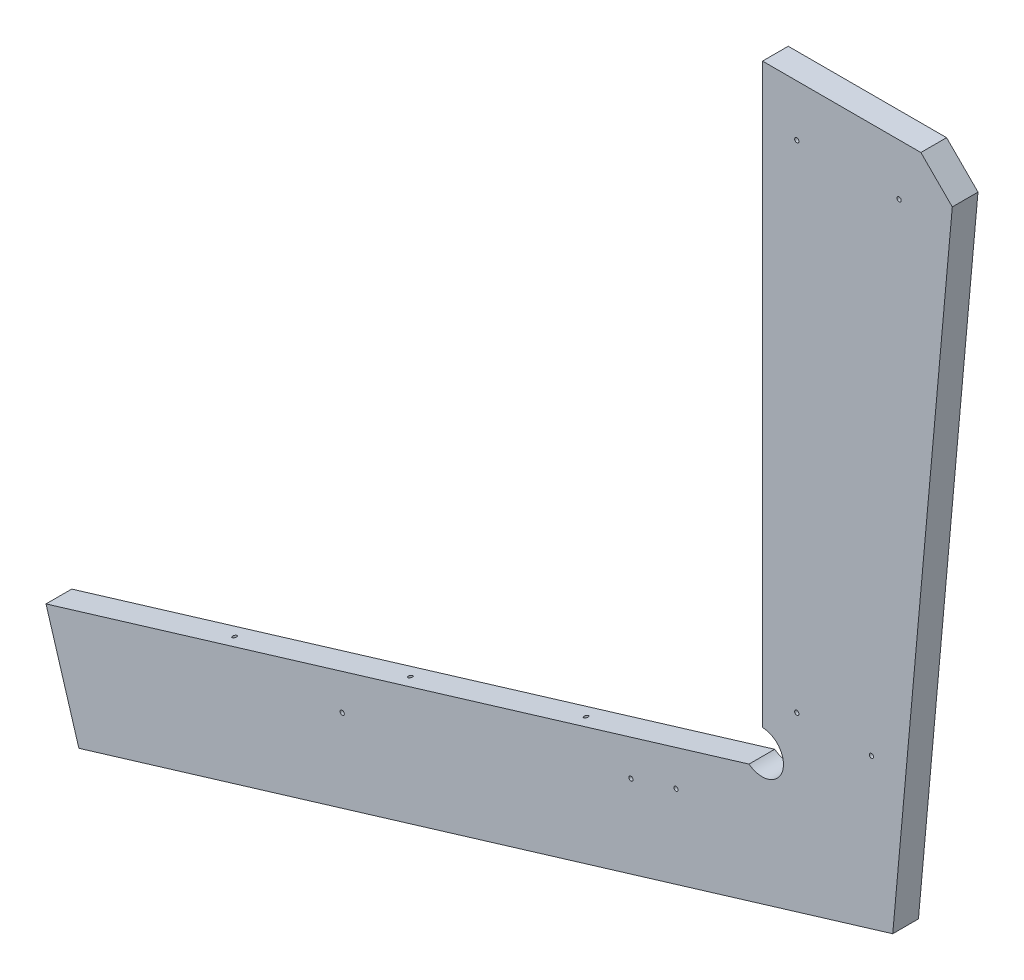
from build123d import *

# Parameters (mm, degrees)
BOSS_EXTRUDE1_DEPTH = 19.05
CHAMFER1_SIZE       = 25.4
CHAMFER1_SIZE2      = 23.3906272
HOLE2_D             = 3.175
HOLE2_DEPTH         = 31.75
HOLE2_CSINK_D       = 10.16
HOLE2_CSINK_ANGLE   = 82
HOLE2_TIP           = 0.953866233
HOLE4_D             = 3.175
HOLE4_DEPTH         = 31.75
HOLE4_CSINK_D       = 10.16
HOLE4_CSINK_ANGLE   = 82
HOLE4_TIP           = 0.953866233
HOLE5_D             = 3.175
HOLE5_DEPTH         = 38.1
HOLE5_CSINK_D       = 10.16
HOLE5_CSINK_ANGLE   = 82
HOLE5_TIP           = 0.953866233
HOLE6_D             = 3.175
HOLE6_DEPTH         = 38.1
HOLE6_CSINK_D       = 10.16
HOLE6_CSINK_ANGLE   = 82
HOLE6_TIP           = 0.953866233


with BuildPart() as part:
    # Sketch1 → Boss-Extrude1 (new body)
    with BuildSketch(Plane.XY):
        with BuildLine():
            Line((12.7, 12.7), (12.7, -415.185594934))
            ThreePointArc((12.7, -415.185594934), (27.339445595, -436.32629993), (2.687239133, -443.641454859))
            Line((2.687239133, -443.641454859), (-518.461959982, -601.369999539))
            Line((-518.461959982, -601.369999539), (-494.089021628, -681.900364725))
            Line((-494.089021628, -681.900364725), (109.245636646, -499.2979588))
            Line((109.245636646, -499.2979588), (155.492294041, 12.7))
            Line((155.492294041, 12.7), (12.7, 12.7))
        make_face()
    extrude(amount=-BOSS_EXTRUDE1_DEPTH)

    # Chamfer1
    chamfer1_edges = [part.edges().sort_by_distance(p)[0] for p in [
        (155.492294041, 12.7, -9.525),
    ]]
    chamfer1_side = [part.faces().sort_by_distance(p)[0] for p in [
        (84.09614702, 12.7, -9.525),
    ]]
    chamfer(chamfer1_edges, length=CHAMFER1_SIZE, length2=CHAMFER1_SIZE2, reference=chamfer1_side[0])

    # Hole2
    with Locations(Plane(origin=(0, 10.424290059, 165.474999994), x_dir=(0, 0, -1), z_dir=(-1, 0, 0))):
        with Locations((-155.949999994, 107.734820482), (155.949999994, 107.734820482), (155.949999994, 327.755881328), (174.999999994, 85.732714397), (174.999999994, 349.757987412), (-174.999999994, 349.757987412), (-174.999999994, 85.732714397), (-155.949999994, 327.755881328)):
            CounterSinkHole(HOLE2_D / 2, HOLE2_CSINK_D / 2, depth=HOLE2_DEPTH, counter_sink_angle=HOLE2_CSINK_ANGLE)
            with Locations((0, 0, -(HOLE2_DEPTH + HOLE2_TIP / 2))):  # 118° drill point
                Cone(0, HOLE2_D / 2, HOLE2_TIP, mode=Mode.SUBTRACT)

    # Hole4
    with Locations(Plane(origin=(264.696145853, -351.074163461, 165.474999994), x_dir=(0, 0, -1), z_dir=(-0.2896786029738453, 0.9571239768071436, 8.258871730585588e-15))):
        with Locations((174.999999994, 685.961004241), (174.999999994, 549.837259632), (174.999999994, 413.713515022), (81.549999997, 779.649723129), (81.549999997, 652.344645962), (62.499999997, 662.953402392), (62.499999997, 769.040966698), (-62.499999997, 769.040966698), (-62.499999997, 662.953402392), (-81.549999997, 652.344645962), (-81.549999997, 779.649723129), (-174.999999994, 413.713515022), (-174.999999994, 549.837259632), (-174.999999994, 685.961004241), (-82.737499997, 600.384620239), (0, 600.384620239), (82.737499997, 600.384620239), (0, 376.737770337), (-82.737499997, 376.737770337), (82.737499997, 376.737770337)):
            CounterSinkHole(HOLE4_D / 2, HOLE4_CSINK_D / 2, depth=HOLE4_DEPTH, counter_sink_angle=HOLE4_CSINK_ANGLE)
            with Locations((0, 0, -(HOLE4_DEPTH + HOLE4_TIP / 2))):  # 118° drill point
                Cone(0, HOLE4_D / 2, HOLE4_TIP, mode=Mode.SUBTRACT)

    # Hole5
    with Locations(Plane(origin=(155.286738577, 10.424290059, -19.05), x_dir=(-0.08995962873759064, -0.9959454127598535, 0), z_dir=(0, 0, -1))):
        with Locations((46.221112845, 113.488854888), (39.39759596, 37.945520226), (412.28786892, 80.423559293), (407.308516105, 25.297013484), (513.561319184, 161.164706775), (597.46020397, 127.267357003), (610.543339245, 159.649253123), (694.322923815, 367.011001477), (526.644454459, 193.546602895), (610.424039029, 400.908351249)):
            CounterSinkHole(HOLE5_D / 2, HOLE5_CSINK_D / 2, depth=HOLE5_DEPTH, counter_sink_angle=HOLE5_CSINK_ANGLE)
            with Locations((0, 0, -(HOLE5_DEPTH + HOLE5_TIP / 2))):  # 118° drill point
                Cone(0, HOLE5_D / 2, HOLE5_TIP, mode=Mode.SUBTRACT)

    # Hole6
    with Locations(Plane(origin=(-643.705760022, -231.394989772, 165.474999994), x_dir=(0, 0, -1), z_dir=(-0.9571239768071421, -0.2896786029738502, -1.2569443472852944e-15))):
        with Locations((-108.649999997, 332.89193461), (108.649999997, 332.89193461), (207.774999994, 332.89193461), (174.999999994, 448.336332751), (135.266666663, 384.042401694), (176.283333328, 384.042401694), (-174.999999994, 448.336332751), (-135.266666663, 384.042401694), (-176.283333328, 384.042401694), (-207.774999994, 332.89193461)):
            CounterSinkHole(HOLE6_D / 2, HOLE6_CSINK_D / 2, depth=HOLE6_DEPTH, counter_sink_angle=HOLE6_CSINK_ANGLE)
            with Locations((0, 0, -(HOLE6_DEPTH + HOLE6_TIP / 2))):  # 118° drill point
                Cone(0, HOLE6_D / 2, HOLE6_TIP, mode=Mode.SUBTRACT)


solid = part.part
